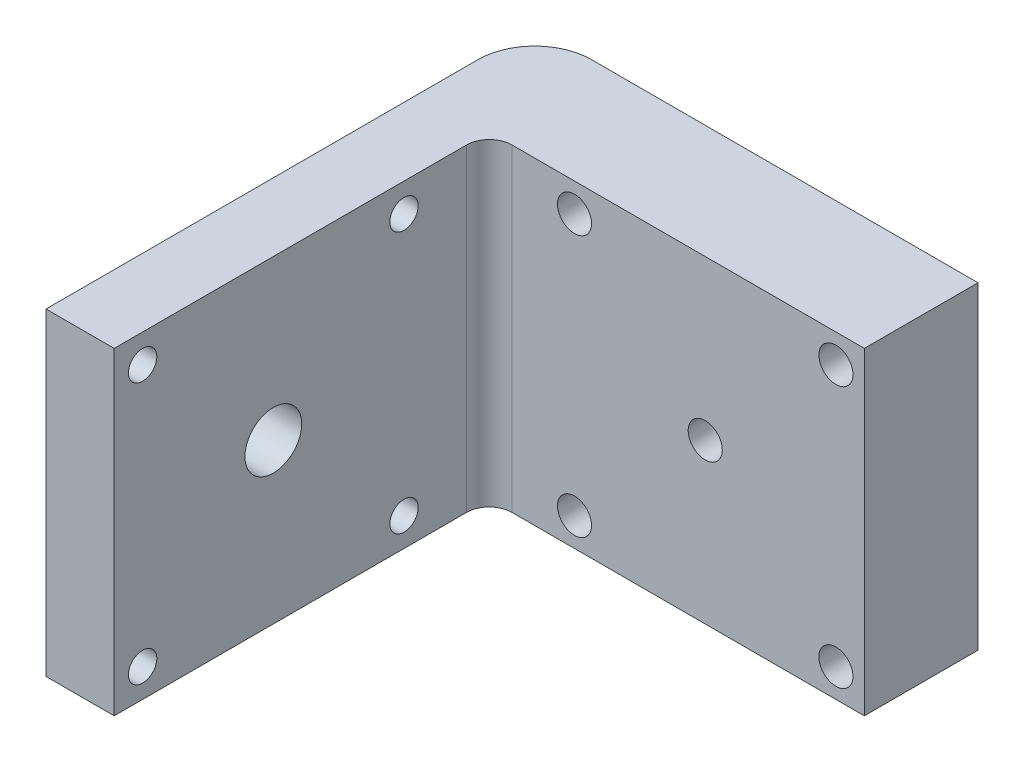
from build123d import *

# Parameters (mm, degrees)
SKETCH_1_W      = 5
SKETCH_1_H      = 28
SKETCH_1_W_2    = 28
SKETCH_1_R      = 1.5
EXTRUDE_1_DEPTH = 10
SKETCH_3_W      = 10
SKETCH_3_H      = 28
SKETCH_3_W_2    = 5
EXTRUDE_3_DEPTH = 6
FILLET_3_R      = 5
FILLET_4_R      = 2


with BuildPart() as part:
    # 草图1 → 凸台-拉伸1 (new body)
    # profile 1 of 2: a face of its own
    with BuildSketch(Plane.XY):
        with Locations((-16.5, 0)):
            Rectangle(SKETCH_1_W, SKETCH_1_H)
    # profile 2 of 2: a face of its own
    with BuildSketch(Plane.XY):
        Rectangle(SKETCH_1_W_2, SKETCH_1_H)
        Circle(SKETCH_1_R, mode=Mode.SUBTRACT)
        with Locations((11.5, -11.5)):
            Circle(SKETCH_1_R, mode=Mode.SUBTRACT)
        with Locations((-11.5, -11.5)):
            Circle(SKETCH_1_R, mode=Mode.SUBTRACT)
        with Locations((11.5, 11.5)):
            Circle(SKETCH_1_R, mode=Mode.SUBTRACT)
        with Locations((-11.5, 11.5)):
            Circle(SKETCH_1_R, mode=Mode.SUBTRACT)
    extrude(amount=EXTRUDE_1_DEPTH)

    # 草图3 → 凸台-拉伸3 (add)
    with BuildSketch(Plane.ZY.offset(19)):
        with Locations((5, 0)):
            Rectangle(SKETCH_3_W, SKETCH_3_H)
        with Locations((12.5, 0)):
            Rectangle(SKETCH_3_W_2, SKETCH_3_H)
        with BuildLine():
            Line((16.616116524, 12.383883476), (15, 14))
            Line((15, 14), (15, -14))
            Line((15, -14), (16.616116524, -12.383883476))
            ThreePointArc((16.616116524, -12.383883476), (16.616116524, -10.616116524), (18.383883476, -10.616116524))
            Line((18.383883476, -10.616116524), (27.232233047, -1.767766953))
            ThreePointArc((27.232233047, -1.767766953), (26.5, 0), (27.232233047, 1.767766953))
            Line((27.232233047, 1.767766953), (18.383883476, 10.616116524))
            ThreePointArc((18.383883476, 10.616116524), (16.616116524, 10.616116524), (16.616116524, 12.383883476))
        make_face()
        with BuildLine():
            Line((43, 14), (15, 14))
            Line((15, 14), (16.616116524, 12.383883476))
            ThreePointArc((16.616116524, 12.383883476), (17.97835429, 12.654849416), (18.75, 11.5))
            ThreePointArc((18.75, 11.5), (18.654849416, 11.02164571), (18.383883476, 10.616116524))
            Line((18.383883476, 10.616116524), (27.232233047, 1.767766953))
            ThreePointArc((27.232233047, 1.767766953), (29, 2.5), (30.767766953, 1.767766953))
            Line((30.767766953, 1.767766953), (39.616116524, 10.616116524))
            ThreePointArc((39.616116524, 10.616116524), (39.616116524, 12.383883476), (41.383883476, 12.383883476))
            Line((41.383883476, 12.383883476), (43, 14))
        make_face()
        with BuildLine():
            Line((43, -14), (43, 14))
            Line((43, 14), (41.383883476, 12.383883476))
            ThreePointArc((41.383883476, 12.383883476), (41.654849416, 11.97835429), (41.75, 11.5))
            ThreePointArc((41.75, 11.5), (40.97835429, 10.345150584), (39.616116524, 10.616116524))
            Line((39.616116524, 10.616116524), (30.767766953, 1.767766953))
            ThreePointArc((30.767766953, 1.767766953), (31.309698831, 0.956708581), (31.5, 0))
            ThreePointArc((31.5, 0), (31.309698831, -0.956708581), (30.767766953, -1.767766953))
            Line((30.767766953, -1.767766953), (39.616116524, -10.616116524))
            ThreePointArc((39.616116524, -10.616116524), (40.97835429, -10.345150584), (41.75, -11.5))
            ThreePointArc((41.75, -11.5), (41.654849416, -11.97835429), (41.383883476, -12.383883476))
            Line((41.383883476, -12.383883476), (43, -14))
        make_face()
        with BuildLine():
            Line((16.616116524, -12.383883476), (15, -14))
            Line((15, -14), (43, -14))
            Line((43, -14), (41.383883476, -12.383883476))
            ThreePointArc((41.383883476, -12.383883476), (39.616116524, -12.383883476), (39.616116524, -10.616116524))
            Line((39.616116524, -10.616116524), (30.767766953, -1.767766953))
            ThreePointArc((30.767766953, -1.767766953), (29, -2.5), (27.232233047, -1.767766953))
            Line((27.232233047, -1.767766953), (18.383883476, -10.616116524))
            ThreePointArc((18.383883476, -10.616116524), (18.654849416, -11.02164571), (18.75, -11.5))
            ThreePointArc((18.75, -11.5), (17.97835429, -12.654849416), (16.616116524, -12.383883476))
        make_face()
    extrude(amount=EXTRUDE_3_DEPTH)

    # 圆角3
    fillet_3_edges = [part.edges().sort_by_distance(p)[0] for p in [
        (-25, 0, 0),
    ]]
    fillet(fillet_3_edges, radius=FILLET_3_R)

    # 圆角4
    fillet_4_edges = [part.edges().sort_by_distance(p)[0] for p in [
        (-19, 0, 10),
    ]]
    fillet(fillet_4_edges, radius=FILLET_4_R)


solid = part.part
